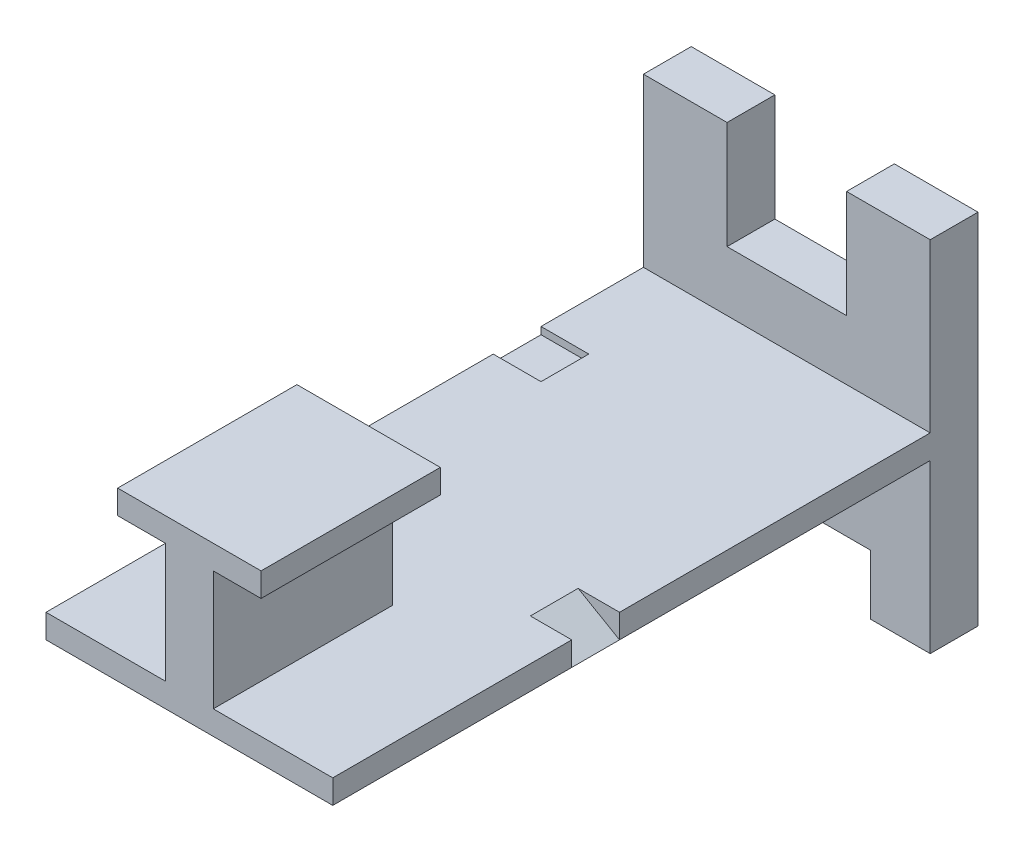
from build123d import *

# Parameters (mm, degrees)
SKETCH_1_W          = 120
SKETCH_1_H          = 150
EXTRUDE_1_DEPTH     = 20
SKETCH_2_W          = 120
SKETCH_2_H          = 10
EXTRUDE_3_DEPTH     = 250
SKETCH_3_W          = 50
SKETCH_3_H          = 45
CUT_EXTRUDE_1_DEPTH = 316.277655409
SKETCH_4_W          = 70
SKETCH_4_H          = 25
CUT_EXTRUDE_2_DEPTH = 316.277655409
SKETCH_5_W          = 20
SKETCH_5_H          = 20
CUT_EXTRUDE_3_DEPTH = 3
CUT_EXTRUDE_START   = -100
CUT_EXTRUDE_6_DEPTH = 20
SKETCH_7_W          = 20
SKETCH_7_H          = 75
EXTRUDE_4_DEPTH     = 50
SKETCH_8_W          = 60
SKETCH_8_H          = 75
EXTRUDE_5_DEPTH     = 10


with BuildPart() as part:
    # Эскиз1 → Бобышка-Вытянуть1 (new body)
    with BuildSketch(Plane.XY):
        with Locations((60, -75)):
            Rectangle(SKETCH_1_W, SKETCH_1_H)
    extrude(amount=EXTRUDE_1_DEPTH)

    # Эскиз2 → Бобышка-Вытянуть3 (add)
    with BuildSketch(Plane.XY.offset(20)):
        with Locations((60, -75)):
            Rectangle(SKETCH_2_W, SKETCH_2_H)
    extrude(amount=EXTRUDE_3_DEPTH)

    # Эскиз3 → Вырез-Вытянуть1 (cut, through all)
    with BuildSketch(Plane.XY.offset(20)):
        with Locations((60, -22.5)):
            Rectangle(SKETCH_3_W, SKETCH_3_H)
    extrude(amount=-CUT_EXTRUDE_1_DEPTH, mode=Mode.SUBTRACT)

    # Эскиз4 → Вырез-Вытянуть2 (cut, through all)
    with BuildSketch(Plane.XY.offset(20)):
        with Locations((60, -137.5)):
            Rectangle(SKETCH_4_W, SKETCH_4_H)
    extrude(amount=-CUT_EXTRUDE_2_DEPTH, mode=Mode.SUBTRACT)

    # Эскиз5 → Вырез-Вытянуть3 (cut)
    with BuildSketch(Plane(origin=(0, -70, 0), x_dir=(1, 0, 0), z_dir=(0, 1, 0))):
        with Locations((10, -72.859885292)):
            Rectangle(SKETCH_5_W, SKETCH_5_H)
    extrude(amount=-CUT_EXTRUDE_3_DEPTH, mode=Mode.SUBTRACT)

    # Эскиз6 → Вырез-Вытянуть6 (cut)
    with BuildSketch(Plane.XY.offset(270).offset(CUT_EXTRUDE_START)):
        Polygon((120, -80), (102.679491924, -70), (120, -70), align=None)
    extrude(amount=-CUT_EXTRUDE_6_DEPTH, mode=Mode.SUBTRACT)

    # Эскиз7 → Бобышка-Вытянуть4 (add)
    with BuildSketch(Plane(origin=(0, -70, 0), x_dir=(1, 0, 0), z_dir=(0, 1, 0))):
        with Locations((60, -232.5)):
            Rectangle(SKETCH_7_W, SKETCH_7_H)
    extrude(amount=EXTRUDE_4_DEPTH)

    # Эскиз8 → Бобышка-Вытянуть5 (add)
    with BuildSketch(Plane(origin=(0, -20, 0), x_dir=(1, 0, 0), z_dir=(0, 1, 0))):
        with Locations((60, -232.5)):
            Rectangle(SKETCH_8_W, SKETCH_8_H)
    extrude(amount=EXTRUDE_5_DEPTH)


solid = part.part
